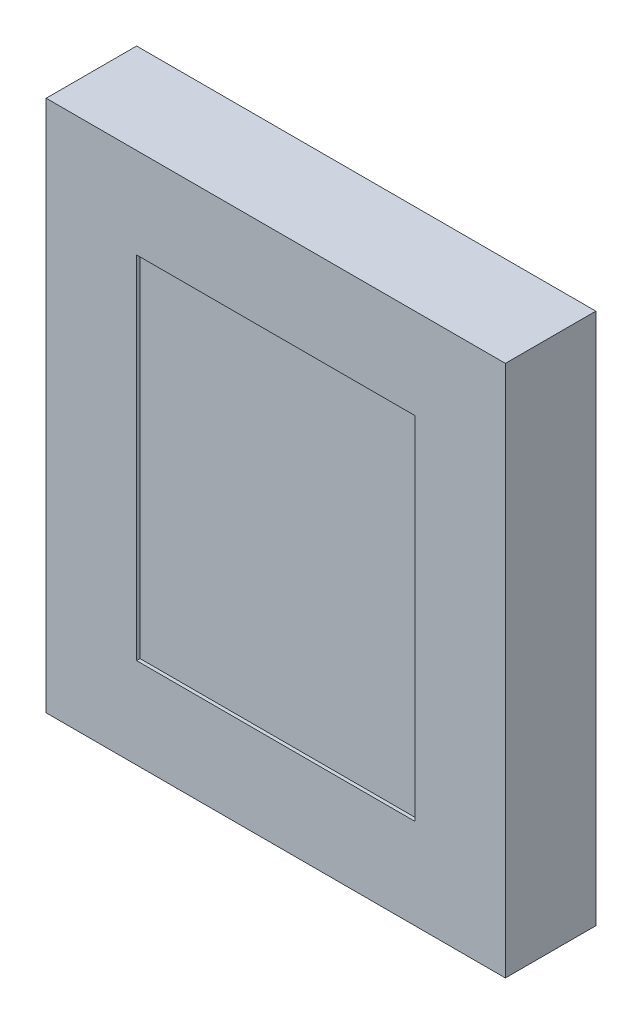
from build123d import *

# Parameters (mm, degrees)
RESSALTO_EXTRUS_O1_DEPTH      = 60
RESSALTO_EXTRUS_O1_DEPTH_BACK = 60
ESBO_O1_W                     = 400
ESBO_O1_H                     = 505
RESSALTO_EXTRUS_O2_DEPTH      = 65
RESSALTO_EXTRUS_O2_DEPTH_BACK = 65
ESBO_O2_W                     = 660
ESBO_O2_H                     = 765
ESBO_O2_W_2                   = 400
ESBO_O2_H_2                   = 505


with BuildPart() as part:
    # Esboço1 → Ressalto-extrusão1 (new, two sides: drawn at the far end of the back side and taken through both)
    with BuildSketch(Plane.XY.offset(-RESSALTO_EXTRUS_O1_DEPTH_BACK)):
        Rectangle(ESBO_O1_W, ESBO_O1_H)
    extrude(amount=RESSALTO_EXTRUS_O1_DEPTH + RESSALTO_EXTRUS_O1_DEPTH_BACK)


with BuildPart() as body_2:
    # Esboço2 → Ressalto-extrusão2 (new, two sides: drawn at the far end of the back side and taken through both)
    with BuildSketch(Plane.XY.offset(-RESSALTO_EXTRUS_O2_DEPTH_BACK)):
        Rectangle(ESBO_O2_W, ESBO_O2_H)
        Rectangle(ESBO_O2_W_2, ESBO_O2_H_2, mode=Mode.SUBTRACT)
    extrude(amount=RESSALTO_EXTRUS_O2_DEPTH + RESSALTO_EXTRUS_O2_DEPTH_BACK)


solid = Compound([part.part, body_2.part])
